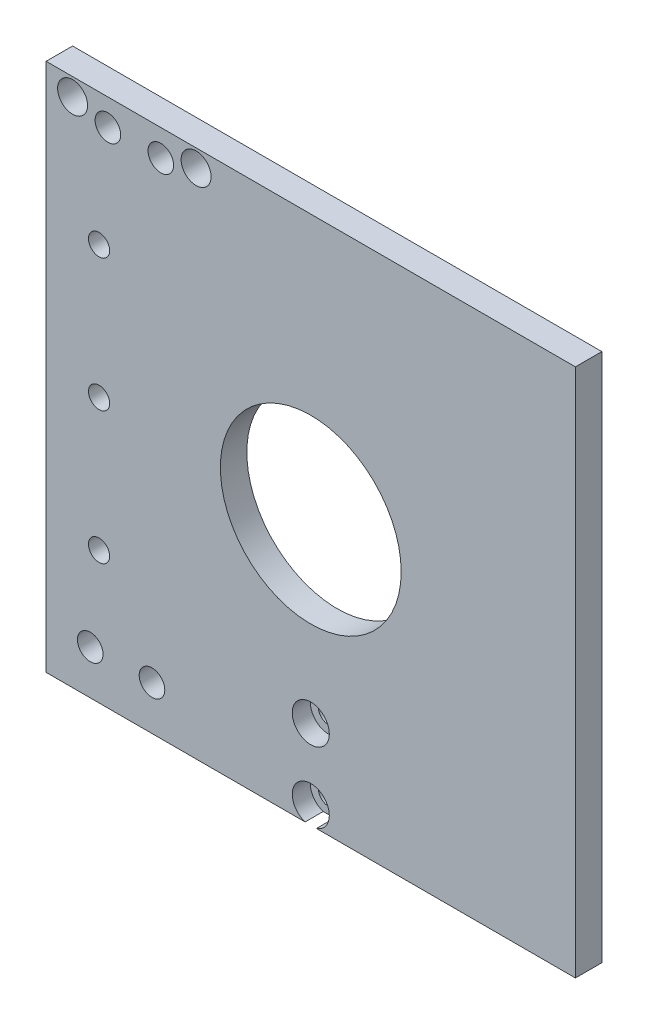
from build123d import *

# Parameters (mm, degrees)
SKETCH1_W                                    = 60
SKETCH1_H                                    = 60
BOSS_EXTRUDE1_DEPTH                          = 3
SKETCH2_R                                    = 10.25
CUT_EXTRUDE1_DEPTH                           = 43.532340636
SKETCH3_R                                    = 1.45
SERVO_Y_MOUNT_D2P9_DEPTH                     = 3.01
SKETCH4_R                                    = 1.45
CUT_EXTRUDE5_DEPTH                           = 43.532340636
SKETCH5_R                                    = 1.2
GUIDERAIL1_D2P4_DEPTH                        = 3.01
SKETCH6_R                                    = 1.2
GUIDEBLOCK2_D2P4_DEPTH                       = 3.01
SKETCH7_R                                    = 2.1
GUIDEBLOCK2_HEADCOUNTERBORE_D4P2_DEPTH       = 2.05
SKETCH8_R                                    = 1.7
BENCH_XDROP_M3_CLEARANCE_HOLES_2X_D3P4_DEPTH = 3.5


with BuildPart() as part:
    # Sketch1 → Boss-Extrude1 (new body)
    with BuildSketch(Plane.XY):
        Rectangle(SKETCH1_W, SKETCH1_H)
    extrude(amount=BOSS_EXTRUDE1_DEPTH)

    # Sketch2 → Cut-Extrude1 (cut, through all)
    with BuildSketch(Plane.XY.offset(3)):
        Circle(SKETCH2_R)
    extrude(amount=-CUT_EXTRUDE1_DEPTH, mode=Mode.SUBTRACT)

    # Sketch3 → Servo_Y_Mount_D2p9 (cut)
    with BuildSketch(Plane(origin=(0, 0, 0), x_dir=(-1, 0, 0), z_dir=(0, 0, -1))):
        with Locations((18, -25)):
            Circle(SKETCH3_R)
        with Locations((25, -25)):
            Circle(SKETCH3_R)
    extrude(amount=-SERVO_Y_MOUNT_D2P9_DEPTH, mode=Mode.SUBTRACT)

    # Sketch4 → Cut-Extrude5 (cut, through all)
    with BuildSketch(Plane(origin=(0, 0, 0), x_dir=(-1, 0, 0), z_dir=(0, 0, -1))):
        with Locations((17, 27)):
            Circle(SKETCH4_R)
        with Locations((23, 27)):
            Circle(SKETCH4_R)
    extrude(amount=-CUT_EXTRUDE5_DEPTH, mode=Mode.SUBTRACT)

    # Sketch5 → GuideRail1_D2p4 (cut)
    with BuildSketch(Plane.XY.offset(3)):
        with Locations((-24, -15)):
            Circle(SKETCH5_R)
        with Locations((-24, 0)):
            Circle(SKETCH5_R)
        with Locations((-24, 15)):
            Circle(SKETCH5_R)
    extrude(amount=-GUIDERAIL1_D2P4_DEPTH, mode=Mode.SUBTRACT)

    # Sketch6 → GuideBlock2_D2p4 (cut)
    with BuildSketch(Plane.XY.offset(3)):
        with Locations((0, -28)):
            Circle(SKETCH6_R)
        with Locations((0, -20)):
            Circle(SKETCH6_R)
    extrude(amount=-GUIDEBLOCK2_D2P4_DEPTH, mode=Mode.SUBTRACT)

    # Sketch7 → GuideBlock2_HeadCounterbore_D4p2 (cut)
    with BuildSketch(Plane.XY.offset(3)):
        with Locations((0, -28)):
            Circle(SKETCH7_R)
        with Locations((0, -20)):
            Circle(SKETCH7_R)
    extrude(amount=-GUIDEBLOCK2_HEADCOUNTERBORE_D4P2_DEPTH, mode=Mode.SUBTRACT)

    # Sketch8 → Bench_XDrop_M3_Clearance_Holes_2x_D3p4 (cut)
    with BuildSketch(Plane.XY.offset(3)):
        with Locations((-27, 28)):
            Circle(SKETCH8_R)
        with Locations((-13, 28)):
            Circle(SKETCH8_R)
    extrude(amount=-BENCH_XDROP_M3_CLEARANCE_HOLES_2X_D3P4_DEPTH, mode=Mode.SUBTRACT)


solid = part.part
